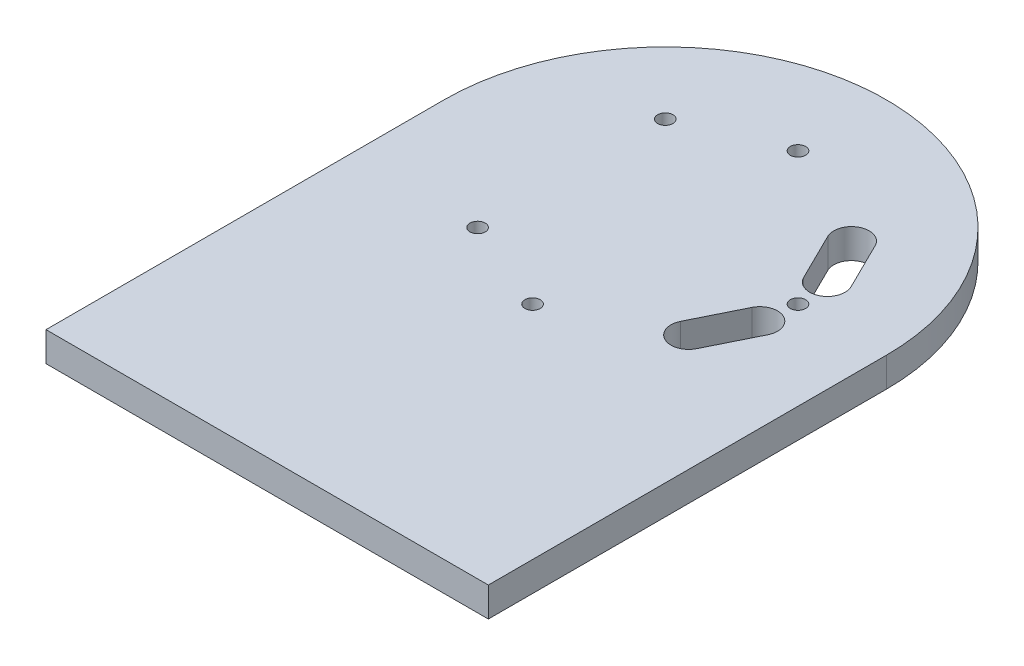
from build123d import *

# Parameters (mm, degrees)
SKETCH1_R           = 47.625
SKETCH1_R_2         = 1.651
BOSS_EXTRUDE1_DEPTH = 6.35


with BuildPart() as part:
    # Sketch1 → Boss-Extrude1 (new body)
    # profile 1 of 3: a face of its own
    with BuildSketch(Plane(origin=(0, 0, 0), x_dir=(1, 0, 0), z_dir=(0, 1, 0))):
        Circle(SKETCH1_R)
        with Locations(Location((0, 28.575, 0), (0, 0, 270))):
            Circle(SKETCH1_R_2, mode=Mode.SUBTRACT)
        with Locations(Location((0, -28.575, 0), (0, 0, 270))):
            Circle(SKETCH1_R_2, mode=Mode.SUBTRACT)
        with Locations(Location((28.575, 0, 0), (0, 0, 270))):
            Circle(SKETCH1_R_2, mode=Mode.SUBTRACT)
        with Locations(Location((-20.205576272, 20.205576272, 0), (0, 0, 270))):
            Circle(SKETCH1_R_2, mode=Mode.SUBTRACT)
        with Locations(Location((-20.205576272, -20.205576272, 0), (0, 0, 270))):
            Circle(SKETCH1_R_2, mode=Mode.SUBTRACT)
        with BuildLine():
            ThreePointArc((25.985410077, 19.213209427), (20.881913097, 20.941364101), (19.153758423, 15.837867121))
            Line((19.153758423, 15.837867121), (24.216771881, 5.59038964))
            ThreePointArc((24.216771881, 5.59038964), (29.320268861, 3.862234966), (31.048423535, 8.965731946))
            Line((31.048423535, 8.965731946), (25.985410077, 19.213209427))
        make_face(mode=Mode.SUBTRACT)
        with BuildLine():
            Line((31.048423535, -8.965731946), (25.985410077, -19.213209427))
            ThreePointArc((25.985410077, -19.213209427), (20.881913097, -20.941364101), (19.153758423, -15.837867121))
            Line((19.153758423, -15.837867121), (24.216771881, -5.59038964))
            ThreePointArc((24.216771881, -5.59038964), (29.320268861, -3.862234966), (31.048423535, -8.965731946))
        make_face(mode=Mode.SUBTRACT)
    # profile 2 of 3: a face of its own
    with BuildSketch(Plane(origin=(0, 0, 0), x_dir=(1, 0, 0), z_dir=(0, 1, 0))):
        with BuildLine():
            Line((0, -85.725), (0, -47.625))
            ThreePointArc((0, -47.625), (-33.675960454, -33.675960454), (-47.625, 0))
            Line((-47.625, 0), (-47.625, -85.725))
            Line((-47.625, -85.725), (0, -85.725))
        make_face()
    # profile 3 of 3: a face of its own
    with BuildSketch(Plane(origin=(0, 0, 0), x_dir=(1, 0, 0), z_dir=(0, 1, 0))):
        with BuildLine():
            ThreePointArc((47.625, 0), (33.675960454, -33.675960454), (0, -47.625))
            Line((0, -47.625), (0, -85.725))
            Line((0, -85.725), (47.625, -85.725))
            Line((47.625, -85.725), (47.625, 0))
        make_face()
    extrude(amount=BOSS_EXTRUDE1_DEPTH)


solid = part.part
